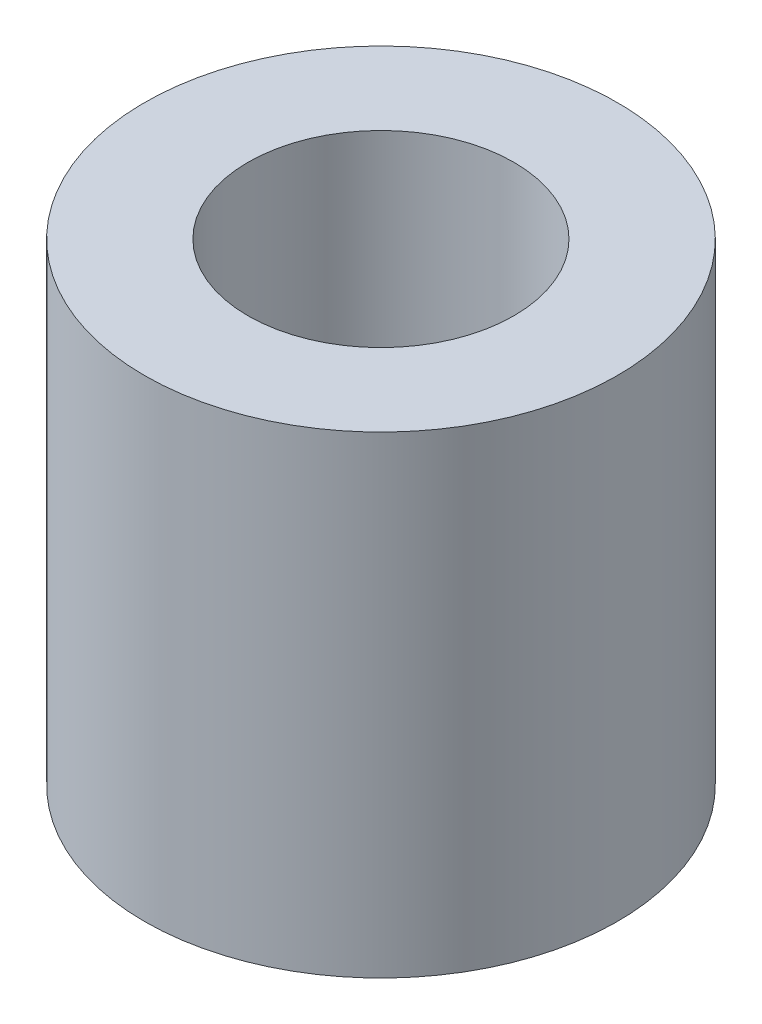
from build123d import *

# Parameters (mm, degrees)
SKETCH1_R           = 4
SKETCH1_R_2         = 2.25
BOSS_EXTRUDE1_DEPTH = 8


with BuildPart() as part:
    # Sketch1 → Boss-Extrude1 (new body)
    with BuildSketch(Plane(origin=(0, 0, 0), x_dir=(1, 0, 0), z_dir=(0, 1, 0))):
        with Locations(Location((0, 0, 0), (0, 0, 270))):
            Circle(SKETCH1_R)
        with Locations(Location((0, 0, 0), (0, 0, 270))):
            Circle(SKETCH1_R_2, mode=Mode.SUBTRACT)
    extrude(amount=BOSS_EXTRUDE1_DEPTH)


solid = part.part
